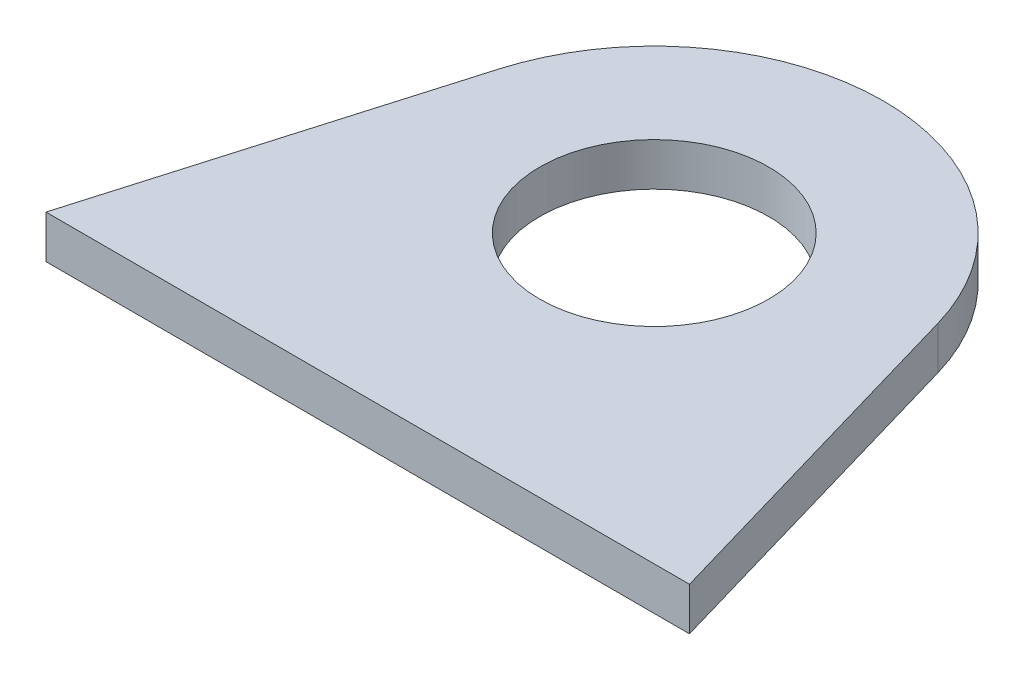
from build123d import *

# Parameters (mm, degrees)
SKETCH1_R           = 16
BOSS_EXTRUDE1_DEPTH = 6


with BuildPart() as part:
    # Sketch1 → Boss-Extrude1 (new body)
    with BuildSketch(Plane(origin=(0, 0, 0), x_dir=(1, 0, 0), z_dir=(0, 1, 0))):
        with BuildLine():
            Line((-30.711719355, 8.988342131), (-45.036894371, -39.9584768))
            Line((-45.036894371, -39.9584768), (44.963105629, -40.04148917))
            Line((44.963105629, -40.04148917), (30.728248053, 8.931672384))
            ThreePointArc((30.728248053, 8.931672384), (0.029515497, 31.999986388), (-30.711719355, 8.988342131))
        make_face()
        with Locations(Location((0, 0, 0), (0, 0, 270))):
            Circle(SKETCH1_R, mode=Mode.SUBTRACT)
    extrude(amount=BOSS_EXTRUDE1_DEPTH)


solid = part.part
